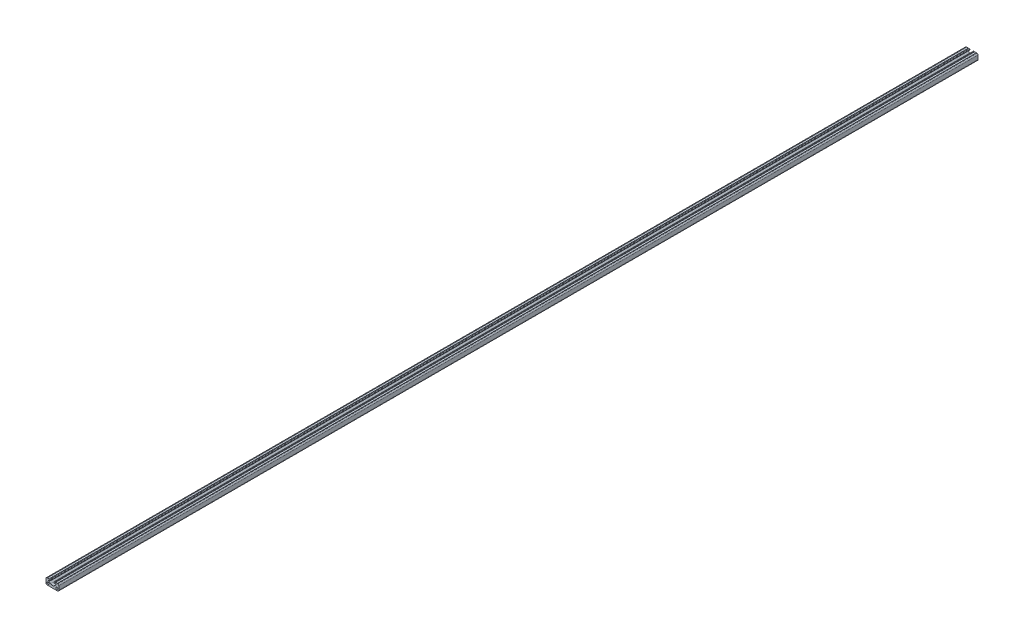
from build123d import *

# Parameters (mm, degrees)
SKETCH3_R               = 2.032
BOSS_EXTRUDE1_DEPTH     = 914.4
CUT_EXTRUDE1_DEPTH      = 915.510236411
CUT_EXTRUDE1_DEPTH_BACK = 915.510236411
SKETCH4_R               = 0.55245


with BuildPart() as part:
    # Sketch3 → Boss-Extrude1 (new, symmetric)
    with BuildSketch(Plane.XY):
        with BuildLine():
            Line((3.2512, 5.35559), (3.2512, 5.13461))
            ThreePointArc((3.2512, 5.13461), (3.542455946, 4.431455946), (4.24561, 4.1402))
            Line((4.24561, 4.1402), (6.42239, 4.1402))
            ThreePointArc((6.42239, 4.1402), (7.341105046, 3.526334232), (7.125544054, 2.442635946))
            Line((7.125544054, 2.442635946), (3.854875946, -0.828032163))
            ThreePointArc((3.854875946, -0.828032163), (2.887046479, -1.474715138), (1.745413783, -1.7018))
            Line((1.745413783, -1.7018), (0, -1.7018))
            Line((0, -1.7018), (0, -6.35))
            Line((0, -6.35), (10.16, -6.35))
            ThreePointArc((10.16, -6.35), (11.956051224, -5.606051224), (12.7, -3.81))
            Line((12.7, -3.81), (12.7, 3.81))
            ThreePointArc((12.7, 3.81), (11.956051224, 5.606051224), (10.16, 6.35))
            Line((10.16, 6.35), (4.24561, 6.35))
            ThreePointArc((4.24561, 6.35), (3.542455946, 6.058744054), (3.2512, 5.35559))
        make_face()
        with Locations(Location((8.7249, -2.3876, 0), (0, 0, 180))):
            Circle(SKETCH3_R, mode=Mode.SUBTRACT)
    extrude(amount=BOSS_EXTRUDE1_DEPTH, both=True)

    # Sketch4 → Cut-Extrude1 (cut, two sides: drawn at the far end of the back side and taken through both)
    with BuildSketch(Plane.XY.offset(-CUT_EXTRUDE1_DEPTH_BACK)):
        with Locations((5.86994, 6.35)):
            Circle(SKETCH4_R)
        with Locations((10.20445, 6.35)):
            Circle(SKETCH4_R)
        with Locations((5.86994, -6.35)):
            Circle(SKETCH4_R)
        with Locations((10.20445, -6.35)):
            Circle(SKETCH4_R)
    extrude(amount=CUT_EXTRUDE1_DEPTH + CUT_EXTRUDE1_DEPTH_BACK, mode=Mode.SUBTRACT)

    # Mirror1: part across plane


with BuildPart() as part_1:
    add(part.part)
    add(part.part.mirror(Plane(origin=(0, 0, 0), x_dir=(0, 0, 1), z_dir=(1, 0, 0))))


solid = part_1.part
